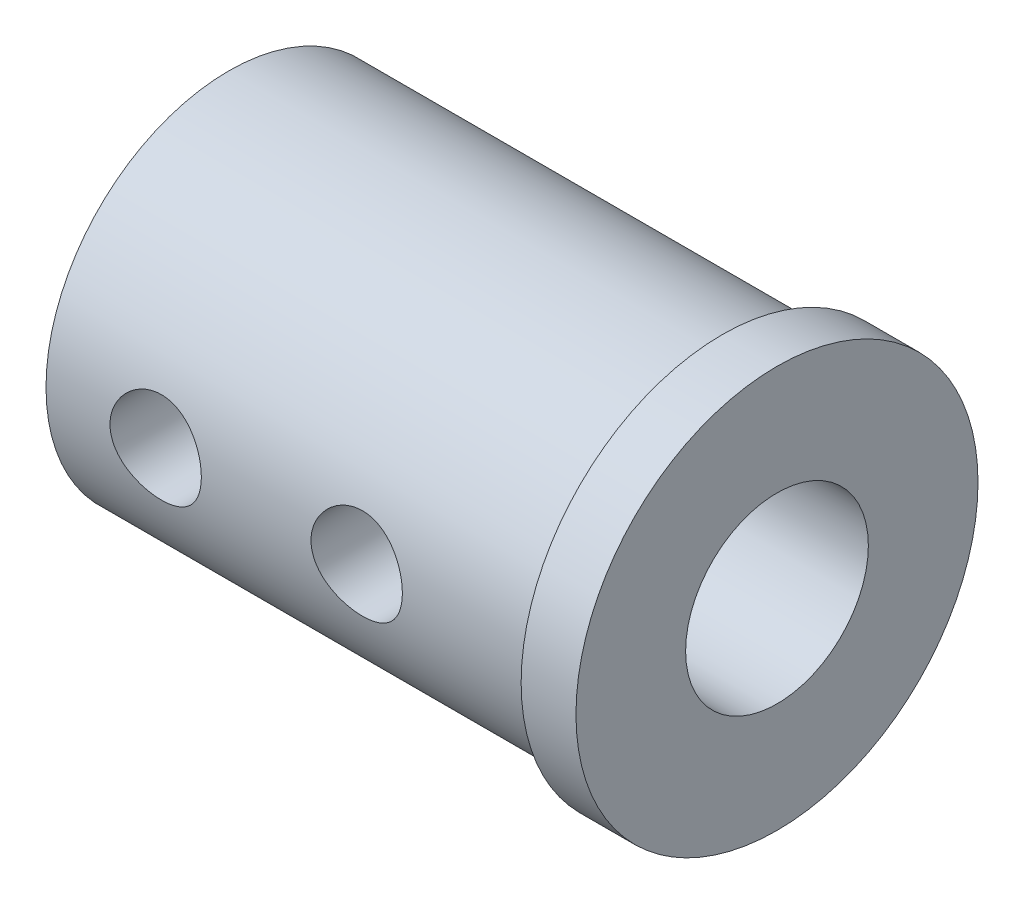
from build123d import *

# Parameters (mm, degrees)
CUT_EXTRUDE1_DEPTH      = 37.773634973
CUT_EXTRUDE1_DEPTH_BACK = 37.773634973
SKETCH2_R               = 2.5


with BuildPart() as part:
    # Sketch1 → Revolve1 (revolve)
    with BuildSketch(Plane.XY, mode=Mode.PRIVATE) as revolve1_sk:
        Polygon((-3.321167883, 11), (-6.321167883, 11), (-6.321167883, 10), (-33.321167883, 10), (-33.321167883, 5), (-3.321167883, 5), align=None)
    revolve(revolve1_sk.sketch.rotate(Axis((0, 0, 0), (-1, 0, 0)), 90), axis=Axis((0, 0, 0), (-1, 0, 0)))

    # Sketch2 → Cut-Extrude1 (cut, two sides: drawn at the far end of the back side and taken through both)
    with BuildSketch(Plane.XY.offset(-CUT_EXTRUDE1_DEPTH_BACK)):
        with Locations((-27.321167883, 0)):
            Circle(SKETCH2_R)
        with Locations((-16.321167883, 0)):
            Circle(SKETCH2_R)
    extrude(amount=CUT_EXTRUDE1_DEPTH + CUT_EXTRUDE1_DEPTH_BACK, mode=Mode.SUBTRACT)


solid = part.part
